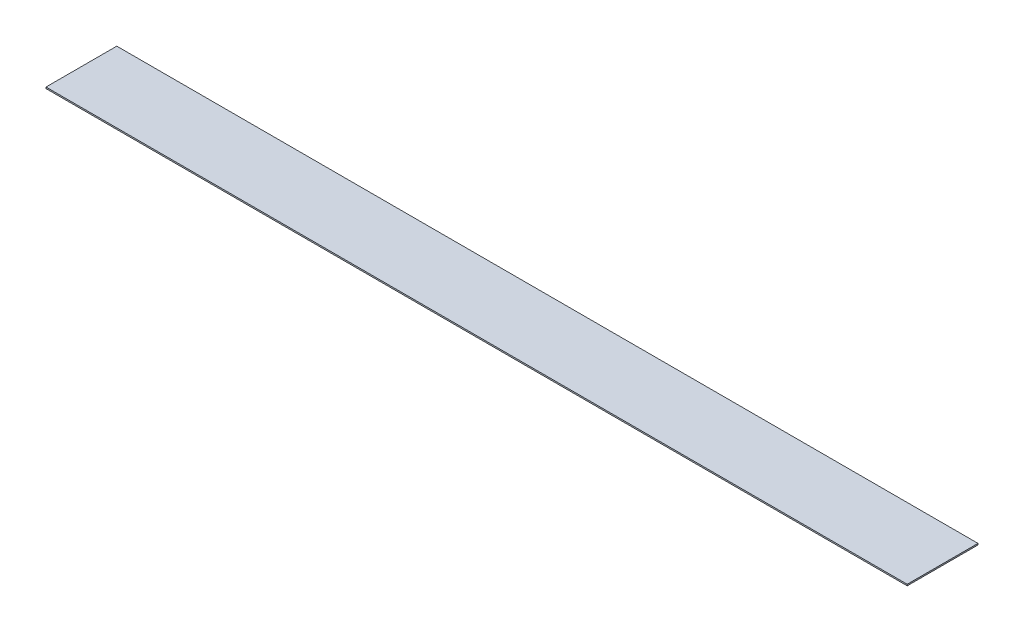
from build123d import *

# Parameters (mm, degrees)
SKETCH1_W           = 1825
SKETCH1_H           = 150
BOSS_EXTRUDE1_DEPTH = 3


with BuildPart() as part:
    # Sketch1 → Boss-Extrude1 (new body)
    with BuildSketch(Plane(origin=(0, 0, 0), x_dir=(1, 0, 0), z_dir=(0, 1, 0))):
        with Locations((912.5, 75)):
            Rectangle(SKETCH1_W, SKETCH1_H)
    extrude(amount=BOSS_EXTRUDE1_DEPTH)


solid = part.part
